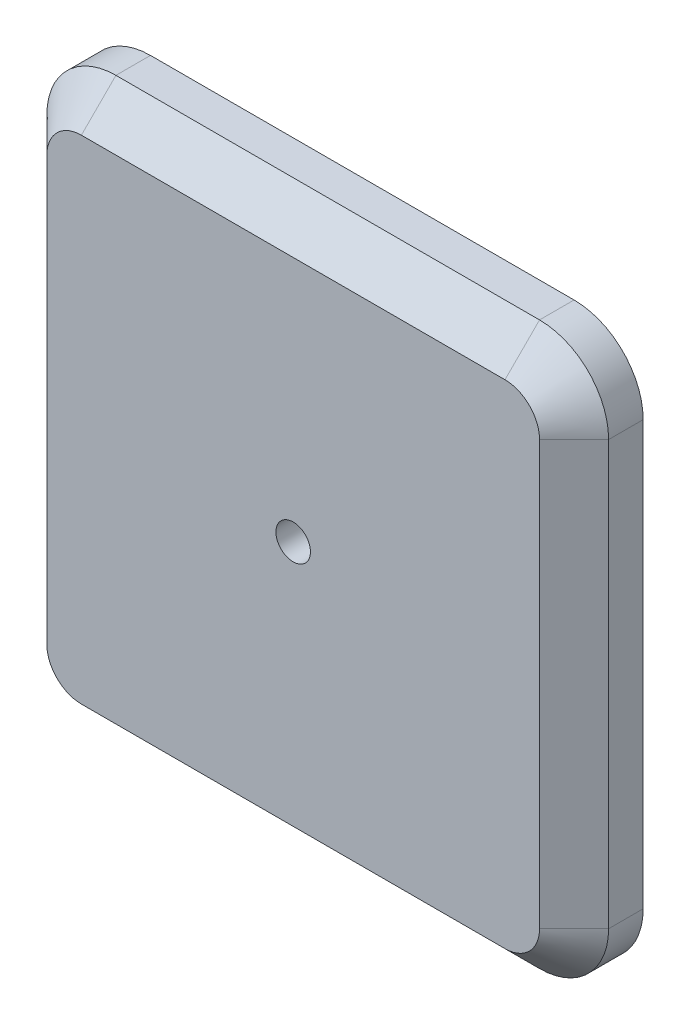
from build123d import *

# Parameters (mm, degrees)
SKETCH1_W           = 32.526911934
SKETCH1_H           = 32.526911934
BOSS_EXTRUDE1_DEPTH = 4
FILLET1_R           = 4
CHAMFER1_SIZE       = 2
SKETCH2_R           = 1
CUT_EXTRUDE1_DEPTH  = 24.34523506


with BuildPart() as part:
    # Sketch1 → Boss-Extrude1 (new body)
    with BuildSketch(Plane.XY):
        Rectangle(SKETCH1_W, SKETCH1_H)
    extrude(amount=BOSS_EXTRUDE1_DEPTH)

    # Fillet1
    fillet1_edges = [part.edges().sort_by_distance(p)[0] for p in [
        (-16.263455967, 16.263455967, 2),
        (16.263455967, 16.263455967, 2),
        (16.263455967, -16.263455967, 2),
        (-16.263455967, -16.263455967, 2),
    ]]
    fillet(fillet1_edges, radius=FILLET1_R)

    # Chamfer1
    chamfer1_edges = [part.edges().sort_by_distance(p)[0] for p in [
        (0, -16.263455967, 4),
        (-16.263455967, 0, 4),
        (16.263455967, 0, 4),
        (0, 16.263455967, 4),
        (-15.091883092, 15.091883092, 4),
        (15.091883092, 15.091883092, 4),
        (15.091883092, -15.091883092, 4),
        (-15.091883092, -15.091883092, 4),
    ]]
    chamfer(chamfer1_edges, length=CHAMFER1_SIZE)

    # Sketch2 → Cut-Extrude1 (cut, through all)
    with BuildSketch(Plane.XY.offset(4)):
        Circle(SKETCH2_R)
    extrude(amount=-CUT_EXTRUDE1_DEPTH, mode=Mode.SUBTRACT)


solid = part.part
